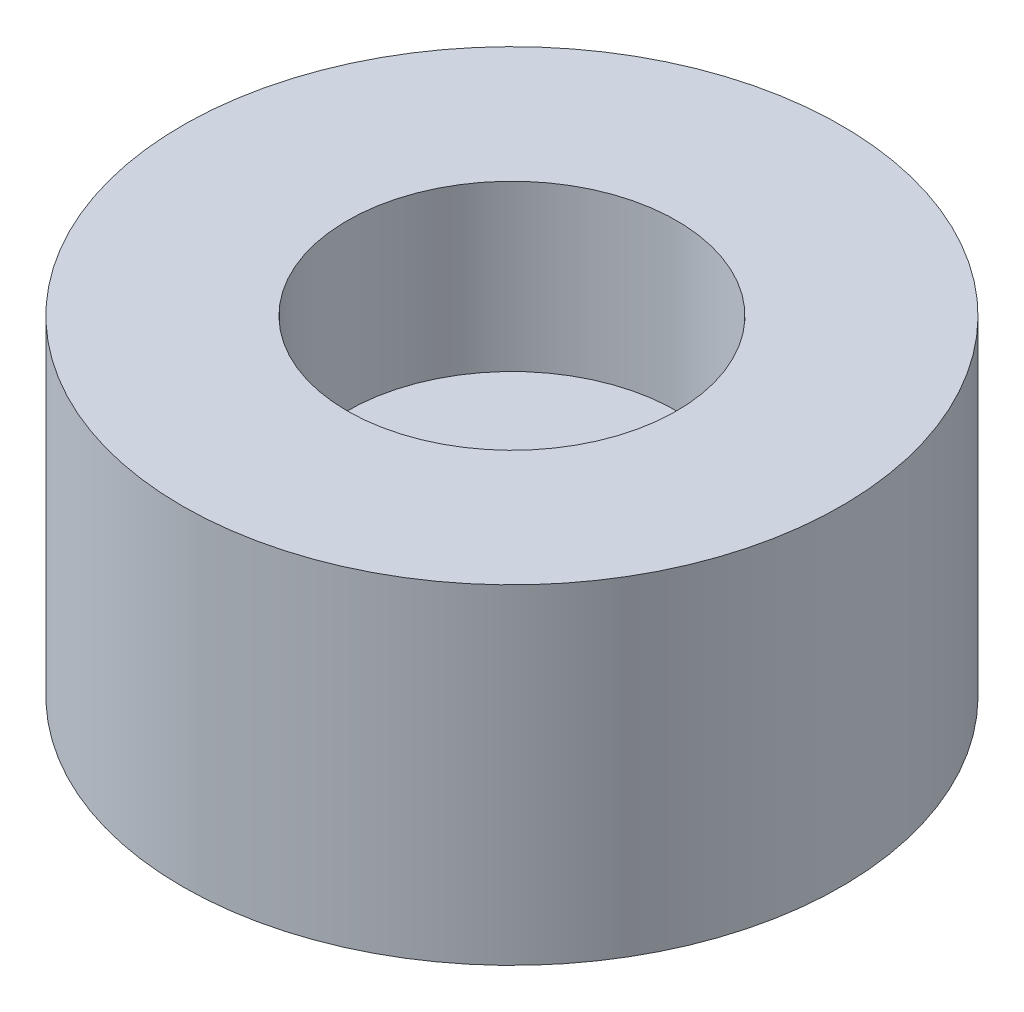
from build123d import *

# Parameters (mm, degrees)
SKETCH1_R           = 5.08
BOSS_EXTRUDE1_DEPTH = 5.08
SKETCH2_R           = 2.54
CUT_EXTRUDE1_DEPTH  = 2.54


with BuildPart() as part:
    # Sketch1 → Boss-Extrude1 (new body)
    with BuildSketch(Plane(origin=(0, 0, 0), x_dir=(1, 0, 0), z_dir=(0, 1, 0))):
        with Locations(Location((0, 0, 0), (0, 0, 270))):
            Circle(SKETCH1_R)
    extrude(amount=BOSS_EXTRUDE1_DEPTH)

    # Sketch2 → Cut-Extrude1 (cut)
    with BuildSketch(Plane(origin=(0, 5.08, 0), x_dir=(1, 0, 0), z_dir=(0, 1, 0))):
        with Locations(Location((0, 0, 0), (0, 0, 270))):
            Circle(SKETCH2_R)
    extrude(amount=-CUT_EXTRUDE1_DEPTH, mode=Mode.SUBTRACT)


solid = part.part
